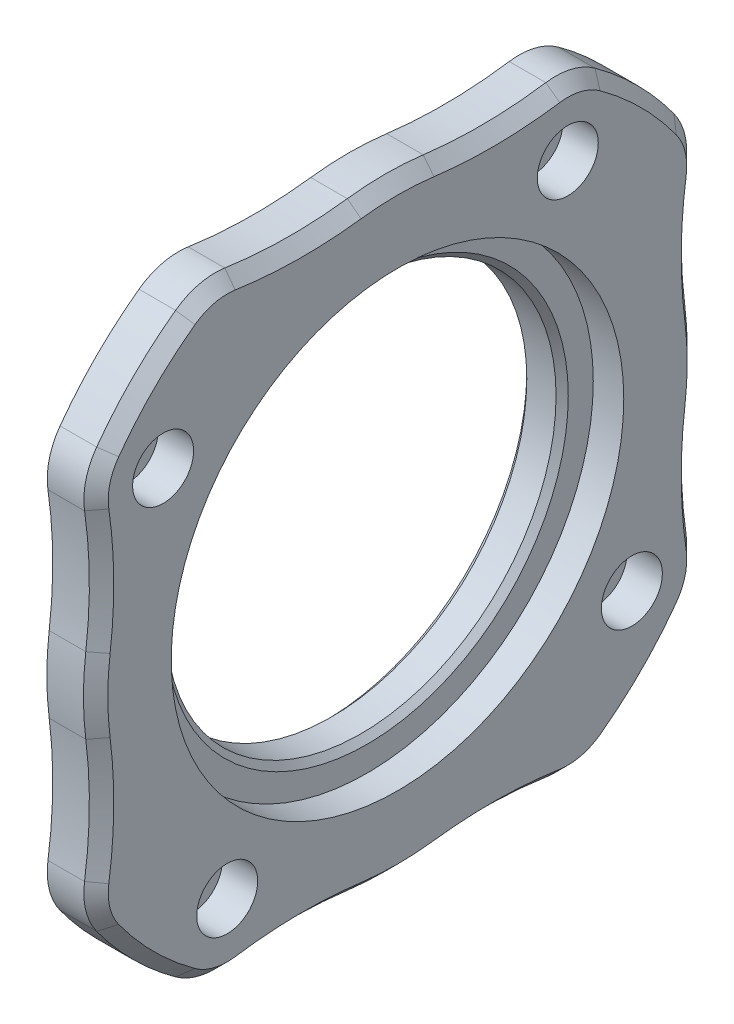
from build123d import *

# Parameters (mm, degrees)
SKETCH_1_R                     = 30
EXTRUDE_1_DEPTH                = 4
EXTRUDE_2_DEPTH                = 1.9
CHAMFER_1_SIZE                 = 1
SKETCH_5_R                     = 16
CUT_EXTRUDE_2_DEPTH            = 43.83468221
HOLE_WIZARD_M2_5_1_D           = 2.7
HOLE_WIZARD_M2_5_1_CBORE_D     = 5
HOLE_WIZARD_M2_5_1_CBORE_DEPTH = 2.9
SKETCH_8_OUTSIDE_W             = 79.012
SKETCH_8_OUTSIDE_H             = 79.012
CUT_EXTRUDE_3_DEPTH            = 43.83468221
CHAMFER_2_SIZE                 = 1
SKETCH_9_R                     = 18.55
CUT_EXTRUDE_4_DEPTH            = 2.5
CHAMFER_3_SIZE                 = 0.5


with BuildPart() as part:
    # 草图1 → 凸台-拉伸1 (new body)
    with BuildSketch(Plane.YZ):
        with Locations(Location((0, 0, 0), (0, 0, 270))):
            Circle(SKETCH_1_R)
    extrude(amount=EXTRUDE_1_DEPTH)

    # 草图2 → 凸台-拉伸2 (add)
    with BuildSketch(Plane(origin=(0, 0, 0), x_dir=(0, -1, 0), z_dir=(-1, 0, 0))):
        with BuildLine():
            ThreePointArc((-15.429362873, -21.236696102), (-14.556584324, -21.641903091), (-13.595407183, -21.687439927))
            ThreePointArc((-13.595407183, -21.687439927), (-8.168716079, -21.262073185), (-2.734521388, -21.577416267))
            ThreePointArc((-2.734521388, -21.577416267), (0, -21.75), (2.734521388, -21.577416267))
            ThreePointArc((2.734521388, -21.577416267), (8.168716079, -21.262073185), (13.595407183, -21.687439927))
            ThreePointArc((13.595407183, -21.687439927), (14.556584324, -21.641903091), (15.429362873, -21.236696102))
            ThreePointArc((15.429362873, -21.236696102), (18.561553006, -18.561553006), (21.236696102, -15.429362873))
            ThreePointArc((21.236696102, -15.429362873), (21.641903091, -14.556584324), (21.687439927, -13.595407183))
            ThreePointArc((21.687439927, -13.595407183), (21.262073185, -8.168716079), (21.577416267, -2.734521388))
            ThreePointArc((21.577416267, -2.734521388), (21.75, 0), (21.577416267, 2.734521388))
            ThreePointArc((21.577416267, 2.734521388), (21.262073185, 8.168716079), (21.687439927, 13.595407183))
            ThreePointArc((21.687439927, 13.595407183), (21.641903091, 14.556584324), (21.236696102, 15.429362873))
            ThreePointArc((21.236696102, 15.429362873), (18.561553006, 18.561553006), (15.429362873, 21.236696102))
            ThreePointArc((15.429362873, 21.236696102), (14.556584324, 21.641903091), (13.595407183, 21.687439927))
            ThreePointArc((13.595407183, 21.687439927), (8.168716079, 21.262073185), (2.734521388, 21.577416267))
            ThreePointArc((2.734521388, 21.577416267), (0, 21.75), (-2.734521388, 21.577416267))
            ThreePointArc((-2.734521388, 21.577416267), (-8.168716079, 21.262073185), (-13.595407183, 21.687439927))
            ThreePointArc((-13.595407183, 21.687439927), (-14.556584324, 21.641903091), (-15.429362873, 21.236696102))
            ThreePointArc((-15.429362873, 21.236696102), (-18.561553006, 18.561553006), (-21.236696102, 15.429362873))
            ThreePointArc((-21.236696102, 15.429362873), (-21.641903091, 14.556584324), (-21.687439927, 13.595407183))
            ThreePointArc((-21.687439927, 13.595407183), (-21.262073185, 8.168716079), (-21.577416267, 2.734521388))
            ThreePointArc((-21.577416267, 2.734521388), (-21.75, 0), (-21.577416267, -2.734521388))
            ThreePointArc((-21.577416267, -2.734521388), (-21.262073185, -8.168716079), (-21.687439927, -13.595407183))
            ThreePointArc((-21.687439927, -13.595407183), (-21.641903091, -14.556584324), (-21.236696102, -15.429362873))
            ThreePointArc((-21.236696102, -15.429362873), (-18.561553006, -18.561553006), (-15.429362873, -21.236696102))
        make_face()
    extrude(amount=EXTRUDE_2_DEPTH)

    # 倒角1
    chamfer_1_edges = [part.edges().sort_by_distance(p)[0] for p in [
        (0, 21.641903091, -14.556584324),
        (0, 18.561553006, -18.561553006),
        (0, 14.556584324, -21.641903091),
        (0, 8.168716079, -21.262073185),
        (0, 0, -21.75),
        (0, -8.168716079, -21.262073185),
        (0, -14.556584324, -21.641903091),
        (0, -18.561553006, -18.561553006),
        (0, -21.641903091, -14.556584324),
        (0, -21.262073185, -8.168716079),
        (0, -21.75, 0),
        (0, -21.262073185, 8.168716079),
        (0, -21.641903091, 14.556584324),
        (0, -18.561553006, 18.561553006),
        (0, -14.556584324, 21.641903091),
        (0, -8.168716079, 21.262073185),
        (0, 0, 21.75),
        (0, 8.168716079, 21.262073185),
        (0, 14.556584324, 21.641903091),
        (0, 18.561553006, 18.561553006),
        (0, 21.641903091, 14.556584324),
        (0, 21.262073185, 8.168716079),
        (0, 21.75, 0),
        (0, 21.262073185, -8.168716079),
    ]]
    chamfer(chamfer_1_edges, length=CHAMFER_1_SIZE)

    # 草图5 → 切除-拉伸2 (cut, through all)
    with BuildSketch(Plane.YZ.offset(4)):
        with Locations(Location((0, 0, 0), (0, 0, 270))):
            Circle(SKETCH_5_R)
    extrude(amount=-CUT_EXTRUDE_2_DEPTH, mode=Mode.SUBTRACT)

    # M2.5 六角圆柱头螺钉的柱形沉头孔1 (through all)
    with Locations(Plane.YZ.offset(4)):
        with Locations((-19.214153616, 13.959899742), (13.959899742, 19.214153616), (19.214153616, -13.959899742), (-13.959899742, -19.214153616)):
            CounterBoreHole(HOLE_WIZARD_M2_5_1_D / 2, HOLE_WIZARD_M2_5_1_CBORE_D / 2, HOLE_WIZARD_M2_5_1_CBORE_DEPTH)

    # 草图8 outside → 切除-拉伸3 (cut, through all)
    with BuildSketch(Plane(origin=(4, 0, 0), x_dir=(0, 0, -1), z_dir=(1, 0, 0))):
        Rectangle(SKETCH_8_OUTSIDE_W, SKETCH_8_OUTSIDE_H)
        with BuildLine():
            ThreePointArc((-3.111696751, 24.553611615), (-8.138326841, 24.261919263), (-13.158016112, 24.6553835))
            ThreePointArc((-13.158016112, 24.6553835), (-15.272605822, 24.55520246), (-17.19271863, 23.663747085))
            ThreePointArc((-17.19271863, 23.663747085), (-20.68287335, 20.68287335), (-23.663747085, 17.19271863))
            ThreePointArc((-23.663747085, 17.19271863), (-24.55520246, 15.272605822), (-24.6553835, 13.158016112))
            ThreePointArc((-24.6553835, 13.158016112), (-24.261919263, 8.138326841), (-24.553611615, 3.111696751))
            ThreePointArc((-24.553611615, 3.111696751), (-24.75, 0), (-24.553611615, -3.111696751))
            ThreePointArc((-24.553611615, -3.111696751), (-24.261919263, -8.138326841), (-24.6553835, -13.158016112))
            ThreePointArc((-24.6553835, -13.158016112), (-24.55520246, -15.272605822), (-23.663747085, -17.19271863))
            ThreePointArc((-23.663747085, -17.19271863), (-20.68287335, -20.68287335), (-17.19271863, -23.663747085))
            ThreePointArc((-17.19271863, -23.663747085), (-15.272605822, -24.55520246), (-13.158016112, -24.6553835))
            ThreePointArc((-13.158016112, -24.6553835), (-8.138326841, -24.261919263), (-3.111696751, -24.553611615))
            ThreePointArc((-3.111696751, -24.553611615), (0, -24.75), (3.111696751, -24.553611615))
            ThreePointArc((3.111696751, -24.553611615), (8.138326841, -24.261919263), (13.158016112, -24.6553835))
            ThreePointArc((13.158016112, -24.6553835), (15.272605822, -24.55520246), (17.19271863, -23.663747085))
            ThreePointArc((17.19271863, -23.663747085), (20.68287335, -20.68287335), (23.663747085, -17.19271863))
            ThreePointArc((23.663747085, -17.19271863), (24.55520246, -15.272605822), (24.6553835, -13.158016112))
            ThreePointArc((24.6553835, -13.158016112), (24.261919263, -8.138326841), (24.553611615, -3.111696751))
            ThreePointArc((24.553611615, -3.111696751), (24.75, 0), (24.553611615, 3.111696751))
            ThreePointArc((24.553611615, 3.111696751), (24.261919263, 8.138326841), (24.6553835, 13.158016112))
            ThreePointArc((24.6553835, 13.158016112), (24.55520246, 15.272605822), (23.663747085, 17.19271863))
            ThreePointArc((23.663747085, 17.19271863), (20.68287335, 20.68287335), (17.19271863, 23.663747085))
            ThreePointArc((17.19271863, 23.663747085), (15.272605822, 24.55520246), (13.158016112, 24.6553835))
            ThreePointArc((13.158016112, 24.6553835), (8.138326841, 24.261919263), (3.111696751, 24.553611615))
            ThreePointArc((3.111696751, 24.553611615), (0, 24.75), (-3.111696751, 24.553611615))
        make_face(mode=Mode.SUBTRACT)
    extrude(amount=-CUT_EXTRUDE_3_DEPTH, mode=Mode.SUBTRACT)

    # 倒角2
    chamfer_2_edges = [part.edges().sort_by_distance(p)[0] for p in [
        (4, 24.75, 0),
        (4, 24.261919263, -8.138326841),
        (4, 24.55520246, -15.272605822),
        (4, 20.68287335, -20.68287335),
        (4, 15.272605822, -24.55520246),
        (4, 8.138326841, -24.261919263),
        (4, 0, -24.75),
        (4, -8.138326841, -24.261919263),
        (4, -15.272605822, -24.55520246),
        (4, -20.68287335, -20.68287335),
        (4, -24.55520246, -15.272605822),
        (4, -24.261919263, -8.138326841),
        (4, -24.75, 0),
        (4, -24.261919263, 8.138326841),
        (4, -24.55520246, 15.272605822),
        (4, -20.68287335, 20.68287335),
        (4, -15.272605822, 24.55520246),
        (4, -8.138326841, 24.261919263),
        (4, 0, 24.75),
        (4, 8.138326841, 24.261919263),
        (4, 15.272605822, 24.55520246),
        (4, 20.68287335, 20.68287335),
        (4, 24.55520246, 15.272605822),
        (4, 24.261919263, 8.138326841),
    ]]
    chamfer(chamfer_2_edges, length=CHAMFER_2_SIZE)

    # 草图9 → 切除-拉伸4 (cut)
    with BuildSketch(Plane(origin=(4, 0, 0), x_dir=(0, 0, -1), z_dir=(1, 0, 0))):
        Circle(SKETCH_9_R)
    extrude(amount=-CUT_EXTRUDE_4_DEPTH, mode=Mode.SUBTRACT)

    # 倒角3
    chamfer_3_edges = [part.edges().sort_by_distance(p)[0] for p in [
        (-1.9, 0, 16),
        (1.5, 0, 16),
    ]]
    chamfer(chamfer_3_edges, length=CHAMFER_3_SIZE)


solid = part.part
